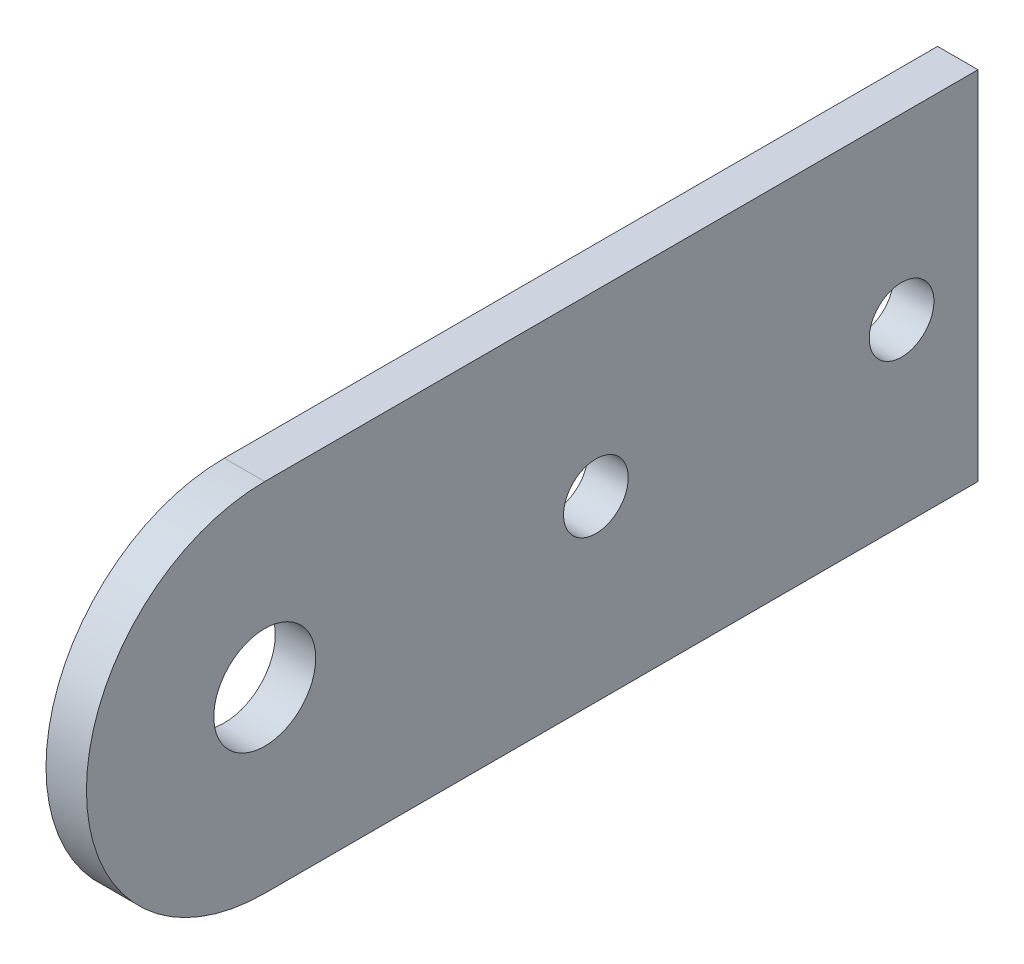
from build123d import *

# Parameters (mm, degrees)
CROQUIS1_R              = 10
CROQUIS1_R_2            = 6.35
SALIENTE_EXTRUIR1_DEPTH = 7.9375


with BuildPart() as part:
    # Croquis1 → Saliente-Extruir1 (new body)
    with BuildSketch(Plane(origin=(0, 0, 0), x_dir=(0, 0, -1), z_dir=(1, 0, 0))):
        with BuildLine():
            Line((0, -35), (140, -35))
            Line((140, -35), (140, 35))
            Line((140, 35), (0, 35))
            ThreePointArc((0, 35), (-35, 0), (0, -35))
        make_face()
        Circle(CROQUIS1_R, mode=Mode.SUBTRACT)
        with Locations((65, 0)):
            Circle(CROQUIS1_R_2, mode=Mode.SUBTRACT)
        with Locations((125, 0)):
            Circle(CROQUIS1_R_2, mode=Mode.SUBTRACT)
    extrude(amount=SALIENTE_EXTRUIR1_DEPTH)


solid = part.part
